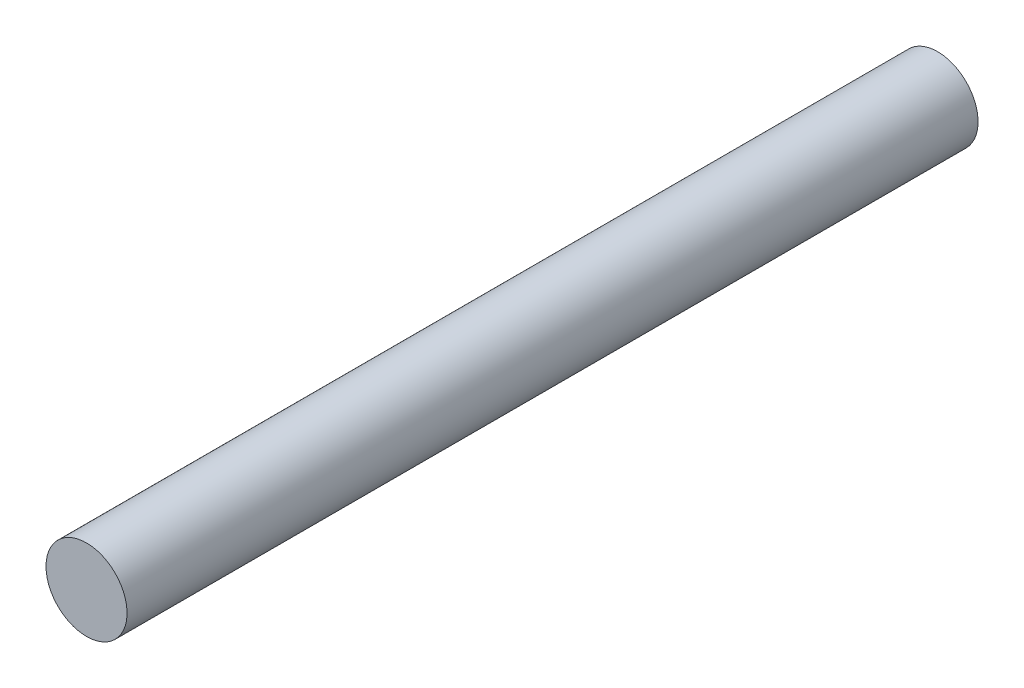
from build123d import *

# Parameters (mm, degrees)
ESQUISSE1_R        = 5
BOSS_EXTRU_1_DEPTH = 105


with BuildPart() as part:
    # Esquisse1 → Boss.-Extru.1 (new body)
    with BuildSketch(Plane.XY):
        with Locations(Location((0, 0, 0), (0, 0, 180))):
            Circle(ESQUISSE1_R)
    extrude(amount=BOSS_EXTRU_1_DEPTH)


solid = part.part
